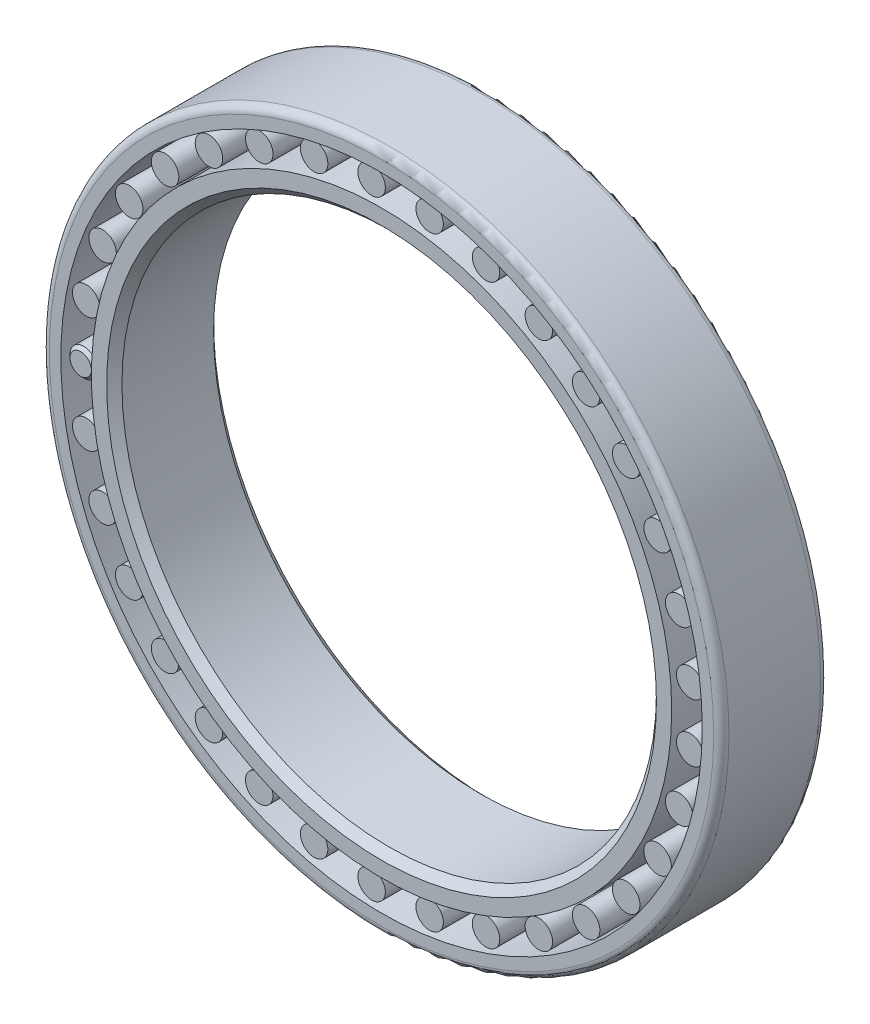
from build123d import *

# Parameters (mm, degrees)
ESQUISSE1_R                  = 22.25
ESQUISSE1_R_2                = 17.5
BOSS_EXTRU_1_DEPTH           = 7
ESQUISSE2_W                  = 2
ESQUISSE2_H                  = 9.790358948
ESQUISSE3_W                  = 0.9
ESQUISSE3_H                  = 6.4
R_P_TITION_CIRCULAIRE1_COUNT = 33
CONG_1_R                     = 0.5
CHANFREIN1_SIZE              = 0.5
CHANFREIN2_SIZE              = 0.2


with BuildPart() as part:
    # Esquisse1 → Boss.-Extru.1 (new body)
    with BuildSketch(Plane.XY):
        Circle(ESQUISSE1_R)
        Circle(ESQUISSE1_R_2, mode=Mode.SUBTRACT)
    extrude(amount=BOSS_EXTRU_1_DEPTH)

    # Esquisse2 → Enlèvement de matière-Révolution1 (revolve, cut)
    with BuildSketch(Plane(origin=(0, 0, 0), x_dir=(1, 0, 0), z_dir=(0, 1, 0)), mode=Mode.PRIVATE) as enl_vement_de_mati_re_r_volution1_sk:
        with Locations((-20, -4.103475313)):
            Rectangle(ESQUISSE2_W, ESQUISSE2_H)
    revolve(enl_vement_de_mati_re_r_volution1_sk.sketch.rotate(Axis((0, 0, 0), (0, 0, 1)), 180), axis=Axis((0, 0, 0), (0, 0, 1)), mode=Mode.SUBTRACT)


with BuildPart() as enl_vement_de_mati_re_r_volution1_piece:
    # of the separate pieces the step leaves, piece 1, a body of its own (enl_vement_de_mati_re_r_volution1_pieces)
    add(part.part.solids().sort_by_distance((19, 0, 0))[0])

    # Chanfrein1
    chanfrein1_edges = [enl_vement_de_mati_re_r_volution1_piece.edges().sort_by_distance(p)[0] for p in [
        (-17.5, 0, 0),
        (-17.5, 0, 7),
    ]]
    chamfer(chanfrein1_edges, length=CHANFREIN1_SIZE)


with BuildPart() as enl_vement_de_mati_re_r_volution1_pi_2:
    # of the separate pieces the step leaves, piece 2, a body of its own (enl_vement_de_mati_re_r_volution1_pieces)
    add(part.part.solids().sort_by_distance((22.25, 0, 0))[0])

    # Congé1
    cong_1_edges = [enl_vement_de_mati_re_r_volution1_pi_2.edges().sort_by_distance(p)[0] for p in [
        (-22.25, 0, 0),
        (-22.25, 0, 7),
    ]]
    fillet(cong_1_edges, radius=CONG_1_R)


with BuildPart() as body_3:
    # Esquisse3 → Révolution1 (revolve)
    with BuildSketch(Plane(origin=(0, 0, 0), x_dir=(1, 0, 0), z_dir=(0, 1, 0)), mode=Mode.PRIVATE) as r_volution1_sk:
        with Locations((-20.45, -3.5)):
            Rectangle(ESQUISSE3_W, ESQUISSE3_H)
    revolve(r_volution1_sk.sketch.rotate(Axis((-20, 0, 8.524927741), (0, 0, -1)), 180), axis=Axis((-20, 0, 8.524927741), (0, 0, -1)))


with BuildPart() as r_p_tition_circulaire1_1:
    # Répétition circulaire1: pattern copy
    add(body_3.part.rotate(Axis((0, 0, 0), (0, 0, 1)), 1 * 360 / R_P_TITION_CIRCULAIRE1_COUNT))


with BuildPart() as r_p_tition_circulaire1_2:
    # Répétition circulaire1: pattern copy
    add(body_3.part.rotate(Axis((0, 0, 0), (0, 0, 1)), 2 * 360 / R_P_TITION_CIRCULAIRE1_COUNT))


with BuildPart() as r_p_tition_circulaire1_3:
    # Répétition circulaire1: pattern copy
    add(body_3.part.rotate(Axis((0, 0, 0), (0, 0, 1)), 3 * 360 / R_P_TITION_CIRCULAIRE1_COUNT))


with BuildPart() as r_p_tition_circulaire1_4:
    # Répétition circulaire1: pattern copy
    add(body_3.part.rotate(Axis((0, 0, 0), (0, 0, 1)), 4 * 360 / R_P_TITION_CIRCULAIRE1_COUNT))


with BuildPart() as r_p_tition_circulaire1_5:
    # Répétition circulaire1: pattern copy
    add(body_3.part.rotate(Axis((0, 0, 0), (0, 0, 1)), 5 * 360 / R_P_TITION_CIRCULAIRE1_COUNT))


with BuildPart() as r_p_tition_circulaire1_6:
    # Répétition circulaire1: pattern copy
    add(body_3.part.rotate(Axis((0, 0, 0), (0, 0, 1)), 6 * 360 / R_P_TITION_CIRCULAIRE1_COUNT))


with BuildPart() as r_p_tition_circulaire1_7:
    # Répétition circulaire1: pattern copy
    add(body_3.part.rotate(Axis((0, 0, 0), (0, 0, 1)), 7 * 360 / R_P_TITION_CIRCULAIRE1_COUNT))


with BuildPart() as r_p_tition_circulaire1_8:
    # Répétition circulaire1: pattern copy
    add(body_3.part.rotate(Axis((0, 0, 0), (0, 0, 1)), 8 * 360 / R_P_TITION_CIRCULAIRE1_COUNT))


with BuildPart() as r_p_tition_circulaire1_9:
    # Répétition circulaire1: pattern copy
    add(body_3.part.rotate(Axis((0, 0, 0), (0, 0, 1)), 9 * 360 / R_P_TITION_CIRCULAIRE1_COUNT))


with BuildPart() as r_p_tition_circulaire1_10:
    # Répétition circulaire1: pattern copy
    add(body_3.part.rotate(Axis((0, 0, 0), (0, 0, 1)), 10 * 360 / R_P_TITION_CIRCULAIRE1_COUNT))


with BuildPart() as r_p_tition_circulaire1_11:
    # Répétition circulaire1: pattern copy
    add(body_3.part.rotate(Axis((0, 0, 0), (0, 0, 1)), 11 * 360 / R_P_TITION_CIRCULAIRE1_COUNT))


with BuildPart() as r_p_tition_circulaire1_12:
    # Répétition circulaire1: pattern copy
    add(body_3.part.rotate(Axis((0, 0, 0), (0, 0, 1)), 12 * 360 / R_P_TITION_CIRCULAIRE1_COUNT))


with BuildPart() as r_p_tition_circulaire1_13:
    # Répétition circulaire1: pattern copy
    add(body_3.part.rotate(Axis((0, 0, 0), (0, 0, 1)), 13 * 360 / R_P_TITION_CIRCULAIRE1_COUNT))


with BuildPart() as r_p_tition_circulaire1_14:
    # Répétition circulaire1: pattern copy
    add(body_3.part.rotate(Axis((0, 0, 0), (0, 0, 1)), 14 * 360 / R_P_TITION_CIRCULAIRE1_COUNT))


with BuildPart() as r_p_tition_circulaire1_15:
    # Répétition circulaire1: pattern copy
    add(body_3.part.rotate(Axis((0, 0, 0), (0, 0, 1)), 15 * 360 / R_P_TITION_CIRCULAIRE1_COUNT))


with BuildPart() as r_p_tition_circulaire1_16:
    # Répétition circulaire1: pattern copy
    add(body_3.part.rotate(Axis((0, 0, 0), (0, 0, 1)), 16 * 360 / R_P_TITION_CIRCULAIRE1_COUNT))


with BuildPart() as r_p_tition_circulaire1_17:
    # Répétition circulaire1: pattern copy
    add(body_3.part.rotate(Axis((0, 0, 0), (0, 0, 1)), 17 * 360 / R_P_TITION_CIRCULAIRE1_COUNT))


with BuildPart() as r_p_tition_circulaire1_18:
    # Répétition circulaire1: pattern copy
    add(body_3.part.rotate(Axis((0, 0, 0), (0, 0, 1)), 18 * 360 / R_P_TITION_CIRCULAIRE1_COUNT))


with BuildPart() as r_p_tition_circulaire1_19:
    # Répétition circulaire1: pattern copy
    add(body_3.part.rotate(Axis((0, 0, 0), (0, 0, 1)), 19 * 360 / R_P_TITION_CIRCULAIRE1_COUNT))


with BuildPart() as r_p_tition_circulaire1_20:
    # Répétition circulaire1: pattern copy
    add(body_3.part.rotate(Axis((0, 0, 0), (0, 0, 1)), 20 * 360 / R_P_TITION_CIRCULAIRE1_COUNT))


with BuildPart() as r_p_tition_circulaire1_21:
    # Répétition circulaire1: pattern copy
    add(body_3.part.rotate(Axis((0, 0, 0), (0, 0, 1)), 21 * 360 / R_P_TITION_CIRCULAIRE1_COUNT))


with BuildPart() as r_p_tition_circulaire1_22:
    # Répétition circulaire1: pattern copy
    add(body_3.part.rotate(Axis((0, 0, 0), (0, 0, 1)), 22 * 360 / R_P_TITION_CIRCULAIRE1_COUNT))


with BuildPart() as r_p_tition_circulaire1_23:
    # Répétition circulaire1: pattern copy
    add(body_3.part.rotate(Axis((0, 0, 0), (0, 0, 1)), 23 * 360 / R_P_TITION_CIRCULAIRE1_COUNT))


with BuildPart() as r_p_tition_circulaire1_24:
    # Répétition circulaire1: pattern copy
    add(body_3.part.rotate(Axis((0, 0, 0), (0, 0, 1)), 24 * 360 / R_P_TITION_CIRCULAIRE1_COUNT))


with BuildPart() as r_p_tition_circulaire1_25:
    # Répétition circulaire1: pattern copy
    add(body_3.part.rotate(Axis((0, 0, 0), (0, 0, 1)), 25 * 360 / R_P_TITION_CIRCULAIRE1_COUNT))


with BuildPart() as r_p_tition_circulaire1_26:
    # Répétition circulaire1: pattern copy
    add(body_3.part.rotate(Axis((0, 0, 0), (0, 0, 1)), 26 * 360 / R_P_TITION_CIRCULAIRE1_COUNT))


with BuildPart() as r_p_tition_circulaire1_27:
    # Répétition circulaire1: pattern copy
    add(body_3.part.rotate(Axis((0, 0, 0), (0, 0, 1)), 27 * 360 / R_P_TITION_CIRCULAIRE1_COUNT))


with BuildPart() as r_p_tition_circulaire1_28:
    # Répétition circulaire1: pattern copy
    add(body_3.part.rotate(Axis((0, 0, 0), (0, 0, 1)), 28 * 360 / R_P_TITION_CIRCULAIRE1_COUNT))


with BuildPart() as r_p_tition_circulaire1_29:
    # Répétition circulaire1: pattern copy
    add(body_3.part.rotate(Axis((0, 0, 0), (0, 0, 1)), 29 * 360 / R_P_TITION_CIRCULAIRE1_COUNT))


with BuildPart() as r_p_tition_circulaire1_30:
    # Répétition circulaire1: pattern copy
    add(body_3.part.rotate(Axis((0, 0, 0), (0, 0, 1)), 30 * 360 / R_P_TITION_CIRCULAIRE1_COUNT))


with BuildPart() as r_p_tition_circulaire1_31:
    # Répétition circulaire1: pattern copy
    add(body_3.part.rotate(Axis((0, 0, 0), (0, 0, 1)), 31 * 360 / R_P_TITION_CIRCULAIRE1_COUNT))


with BuildPart() as r_p_tition_circulaire1_32:
    # Répétition circulaire1: pattern copy
    add(body_3.part.rotate(Axis((0, 0, 0), (0, 0, 1)), 32 * 360 / R_P_TITION_CIRCULAIRE1_COUNT))


with BuildPart() as body_3_1:
    add(body_3.part)

    # Chanfrein2
    chanfrein2_edges = [body_3_1.edges().sort_by_distance(p)[0] for p in [
        (-20.9, 0, 6.7),
        (-20.9, 0, 0.3),
    ]]
    chamfer(chanfrein2_edges, length=CHANFREIN2_SIZE)


solid = Compound([enl_vement_de_mati_re_r_volution1_piece.part, enl_vement_de_mati_re_r_volution1_pi_2.part, r_p_tition_circulaire1_1.part, r_p_tition_circulaire1_2.part, r_p_tition_circulaire1_3.part, r_p_tition_circulaire1_4.part, r_p_tition_circulaire1_5.part, r_p_tition_circulaire1_6.part, r_p_tition_circulaire1_7.part, r_p_tition_circulaire1_8.part, r_p_tition_circulaire1_9.part, r_p_tition_circulaire1_10.part, r_p_tition_circulaire1_11.part, r_p_tition_circulaire1_12.part, r_p_tition_circulaire1_13.part, r_p_tition_circulaire1_14.part, r_p_tition_circulaire1_15.part, r_p_tition_circulaire1_16.part, r_p_tition_circulaire1_17.part, r_p_tition_circulaire1_18.part, r_p_tition_circulaire1_19.part, r_p_tition_circulaire1_20.part, r_p_tition_circulaire1_21.part, r_p_tition_circulaire1_22.part, r_p_tition_circulaire1_23.part, r_p_tition_circulaire1_24.part, r_p_tition_circulaire1_25.part, r_p_tition_circulaire1_26.part, r_p_tition_circulaire1_27.part, r_p_tition_circulaire1_28.part, r_p_tition_circulaire1_29.part, r_p_tition_circulaire1_30.part, r_p_tition_circulaire1_31.part, r_p_tition_circulaire1_32.part, body_3_1.part])
